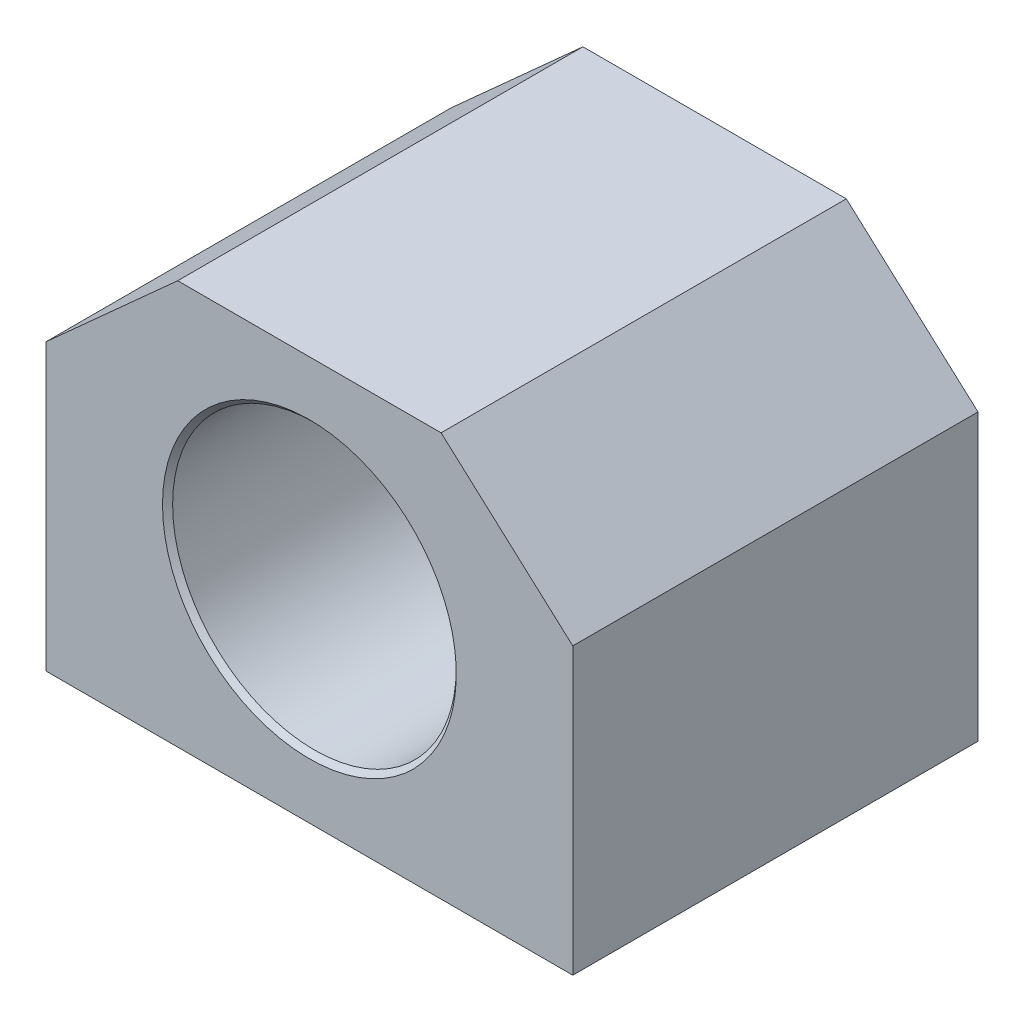
from build123d import *

# Parameters (mm, degrees)
SALIENTE_EXTRUIR1_DEPTH       = 20
CROQUIS2_R                    = 14
CORTAR_EXTRUIR1_DEPTH         = 63.174085438
CHAFL_N1_SIZE                 = 0.5
TALADRO_ROSCADO_M5X0_81_D     = 4.2
TALADRO_ROSCADO_M5X0_81_DEPTH = 16
TALADRO_ROSCADO_M5X0_81_TIP   = 1.2618073


with BuildPart() as part:
    # Croquis1 → Saliente-Extruir1 (new, symmetric)
    with BuildSketch(Plane.XY):
        Polygon((26, 0), (-26, 0), (-26, 28.154625486), (-13, 39.87), (13, 39.87), (26, 28.154625486), align=None)
    extrude(amount=SALIENTE_EXTRUIR1_DEPTH, both=True)

    # Croquis2 → Cortar-Extruir1 (cut, through all)
    with BuildSketch(Plane.XY.offset(20)):
        with Locations((0, 20)):
            Circle(CROQUIS2_R)
    extrude(amount=-CORTAR_EXTRUIR1_DEPTH, mode=Mode.SUBTRACT)

    # Chaflán1
    chafl_n1_edges = [part.edges().sort_by_distance(p)[0] for p in [
        (-14, 20, -20),
        (-14, 20, 20),
    ]]
    chamfer(chafl_n1_edges, length=CHAFL_N1_SIZE)

    # Taladro roscado M5x0.81
    with Locations(Plane(origin=(0, 0, 0), x_dir=(-1, 0, 0), z_dir=(0, -1, 0))):
        with Locations((-20, -12), (20, -12), (20, 12), (-20, 12)):
            Hole(TALADRO_ROSCADO_M5X0_81_D / 2, depth=TALADRO_ROSCADO_M5X0_81_DEPTH)
            with Locations((0, 0, -(TALADRO_ROSCADO_M5X0_81_DEPTH + TALADRO_ROSCADO_M5X0_81_TIP / 2))):  # 118° drill point
                Cone(0, TALADRO_ROSCADO_M5X0_81_D / 2, TALADRO_ROSCADO_M5X0_81_TIP, mode=Mode.SUBTRACT)


solid = part.part
